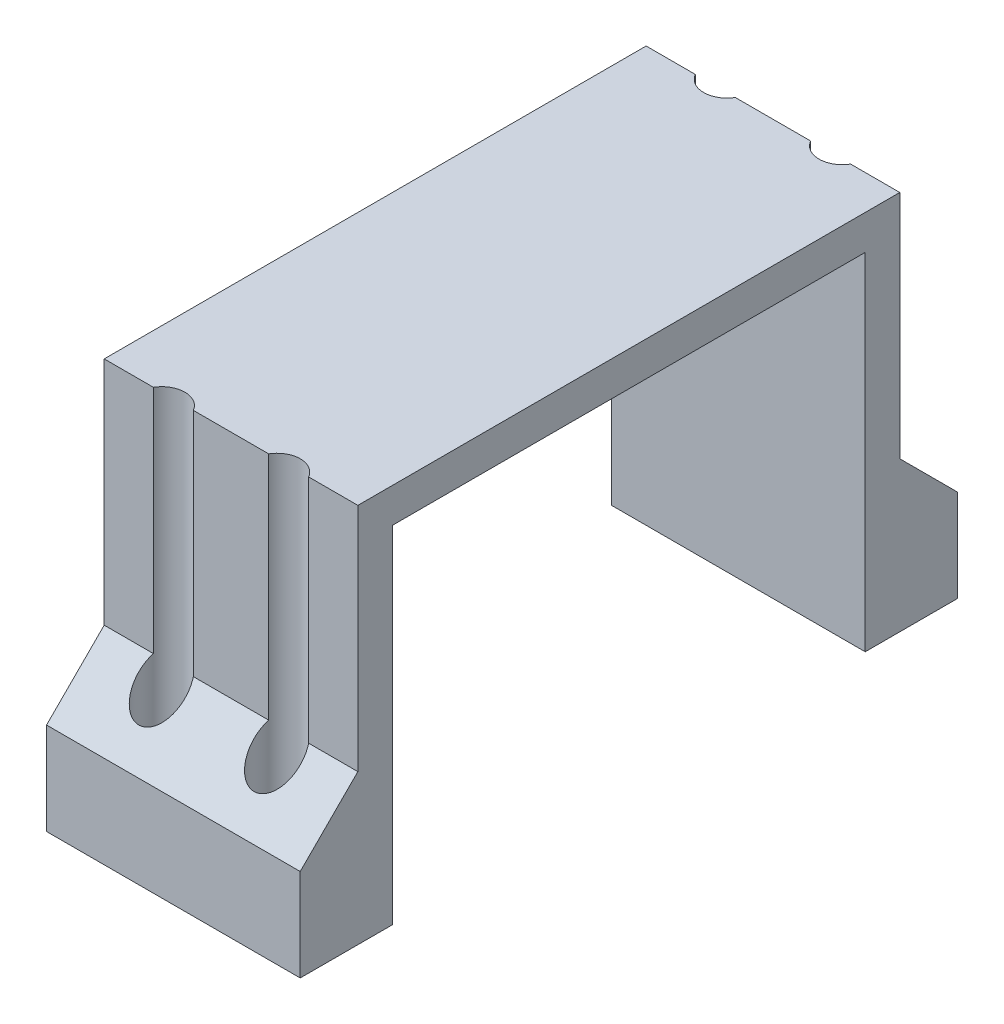
from build123d import *

# Parameters (mm, degrees)
CROQUIS1_W              = 22
CROQUIS1_H              = 47
SALIENTE_EXTRUIR1_DEPTH = 3
CROQUIS2_W              = 22
CROQUIS2_H              = 3
SALIENTE_EXTRUIR2_DEPTH = 30
SALIENTE_EXTRUIR3_DEPTH = 11
CROQUIS5_R              = 2
CORTAR_EXTRUIR1_DEPTH   = 45.969434064


with BuildPart() as part:
    # Croquis1 → Saliente-Extruir1 (new body)
    with BuildSketch(Plane(origin=(0, 0, 0), x_dir=(1, 0, 0), z_dir=(0, 1, 0))):
        Rectangle(CROQUIS1_W, CROQUIS1_H)
    extrude(amount=SALIENTE_EXTRUIR1_DEPTH)

    # Croquis2 → Saliente-Extruir2 (add)
    with BuildSketch(Plane.XZ):
        with Locations((0, 22)):
            Rectangle(CROQUIS2_W, CROQUIS2_H)
        with Locations((0, -22)):
            Rectangle(CROQUIS2_W, CROQUIS2_H)
    extrude(amount=SALIENTE_EXTRUIR2_DEPTH)

    # Croquis4 → Saliente-Extruir3 (add, symmetric)
    with BuildSketch(Plane(origin=(0, 0, 0), x_dir=(0, 0, -1), z_dir=(1, 0, 0))):
        Polygon((23.5, -30), (28.5, -30), (28.5, -22), (23.5, -17), align=None)
    saliente_extruir3 = extrude(amount=SALIENTE_EXTRUIR3_DEPTH, both=True)

    # Croquis5 → Cortar-Extruir1 (cut, symmetric)
    with BuildSketch(Plane.XZ.offset(30)):
        with Locations(Location((5, -24.5, 0), (0, 0, 150))):
            Circle(CROQUIS5_R)
        with Locations(Location((-5, -24.5, 0), (0, 0, 150))):
            Circle(CROQUIS5_R)
    cortar_extruir1 = extrude(amount=CORTAR_EXTRUIR1_DEPTH, both=True, mode=Mode.SUBTRACT)

    # Simetría1: Saliente-Extruir3, Cortar-Extruir1 across plane
    add(saliente_extruir3.mirror(Plane.XY))
    add(cortar_extruir1.mirror(Plane.XY), mode=Mode.SUBTRACT)


solid = part.part
